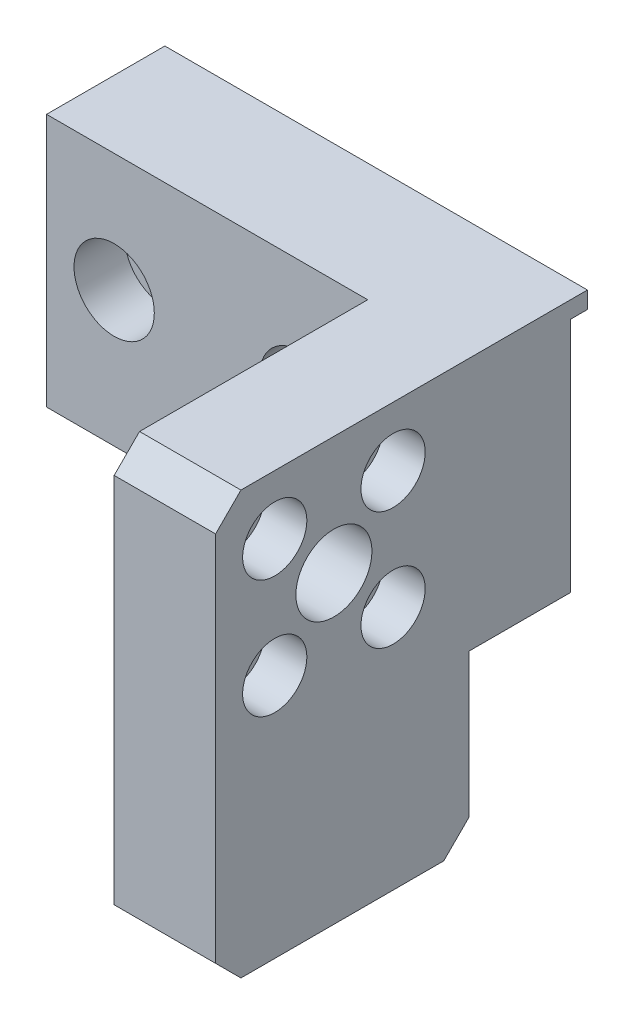
from build123d import *

# Parameters (mm, degrees)
EXTRUDE_1_DEPTH           = 15
SKETCH_2_R                = 6
CUT_EXTRUDE_1_DEPTH       = 4
SKETCH_3_R                = 4.5
CUT_EXTRUDE_2_DEPTH       = 69.271516755
HOLE_WIZARD_1_D           = 4.5
HOLE_WIZARD_1_DEPTH       = 100
HOLE_WIZARD_1_CBORE_D     = 7.6
HOLE_WIZARD_1_CBORE_DEPTH = 5
HOLE_WIZARD_2_D           = 5.5
HOLE_WIZARD_2_DEPTH       = 100
HOLE_WIZARD_2_CBORE_D     = 9.5
HOLE_WIZARD_2_CBORE_DEPTH = 6
SKETCH_8_W                = 12
SKETCH_8_H                = 30
EXTRUDE_2_DEPTH           = 20
CHAMFER_1_SIZE            = 3
SKETCH_10_W               = 2
SKETCH_10_H               = 28
CUT_EXTRUDE_4_DEPTH       = 76.239617224


with BuildPart() as part:
    # 草图1 → 凸台-拉伸1 (new, symmetric)
    with BuildSketch(Plane(origin=(0, 0, 0), x_dir=(1, 0, 0), z_dir=(0, 1, 0))):
        Polygon((-25, 0), (25, 0), (25, -44), (13, -44), (13, -14), (-25, -14), align=None)
    extrude(amount=EXTRUDE_1_DEPTH, both=True)

    # 草图2 → 切除-拉伸1 (cut)
    with BuildSketch(Plane(origin=(13, 0, 0), x_dir=(0, 0, -1), z_dir=(1, 0, 0))):
        with Locations((-30, 1)):
            Circle(SKETCH_2_R)
    extrude(amount=CUT_EXTRUDE_1_DEPTH, mode=Mode.SUBTRACT)

    # 草图3 → 切除-拉伸2 (cut, through all)
    with BuildSketch(Plane(origin=(25, 0, 0), x_dir=(0, 0, -1), z_dir=(1, 0, 0))):
        with Locations((-30, 1)):
            Circle(SKETCH_3_R)
    extrude(amount=-CUT_EXTRUDE_2_DEPTH, mode=Mode.SUBTRACT)

    # 孔1
    with Locations(Plane(origin=(25, 11.754948617, 2.830371217), x_dir=(0, 0, -1), z_dir=(1, 0, 0))):
        with Locations((-20.169628783, -3.754948617), (-34.169628783, -3.754948617), (-20.169628783, -17.754948617), (-34.169628783, -17.754948617)):
            CounterBoreHole(HOLE_WIZARD_1_D / 2, HOLE_WIZARD_1_CBORE_D / 2, HOLE_WIZARD_1_CBORE_DEPTH, depth=HOLE_WIZARD_1_DEPTH)

    # 孔2
    with Locations(Plane(origin=(-5.053295234, -5.294643146, 14), x_dir=(1, 0, 0), z_dir=(0, 0, 1))):
        with Locations((10.053295234, 6.294643146), (-11.946704766, 6.294643146)):
            CounterBoreHole(HOLE_WIZARD_2_D / 2, HOLE_WIZARD_2_CBORE_D / 2, HOLE_WIZARD_2_CBORE_DEPTH, depth=HOLE_WIZARD_2_DEPTH)

    # 草图8 → 凸台-拉伸2 (add)
    with BuildSketch(Plane.XZ.offset(15)):
        with Locations((19, 29)):
            Rectangle(SKETCH_8_W, SKETCH_8_H)
    extrude(amount=EXTRUDE_2_DEPTH)

    # 倒角1
    chamfer_1_edges = [part.edges().sort_by_distance(p)[0] for p in [
        (19, 15, 44),
        (19, -35, 44),
        (19, -35, 14),
    ]]
    chamfer(chamfer_1_edges, length=CHAMFER_1_SIZE)

    # 草图10 → 切除-拉伸4 (cut, through all)
    with BuildSketch(Plane(origin=(25, 0, 0), x_dir=(0, 0, -1), z_dir=(1, 0, 0))):
        with Locations((-1, -1)):
            Rectangle(SKETCH_10_W, SKETCH_10_H)
    extrude(amount=-CUT_EXTRUDE_4_DEPTH, mode=Mode.SUBTRACT)


solid = part.part
